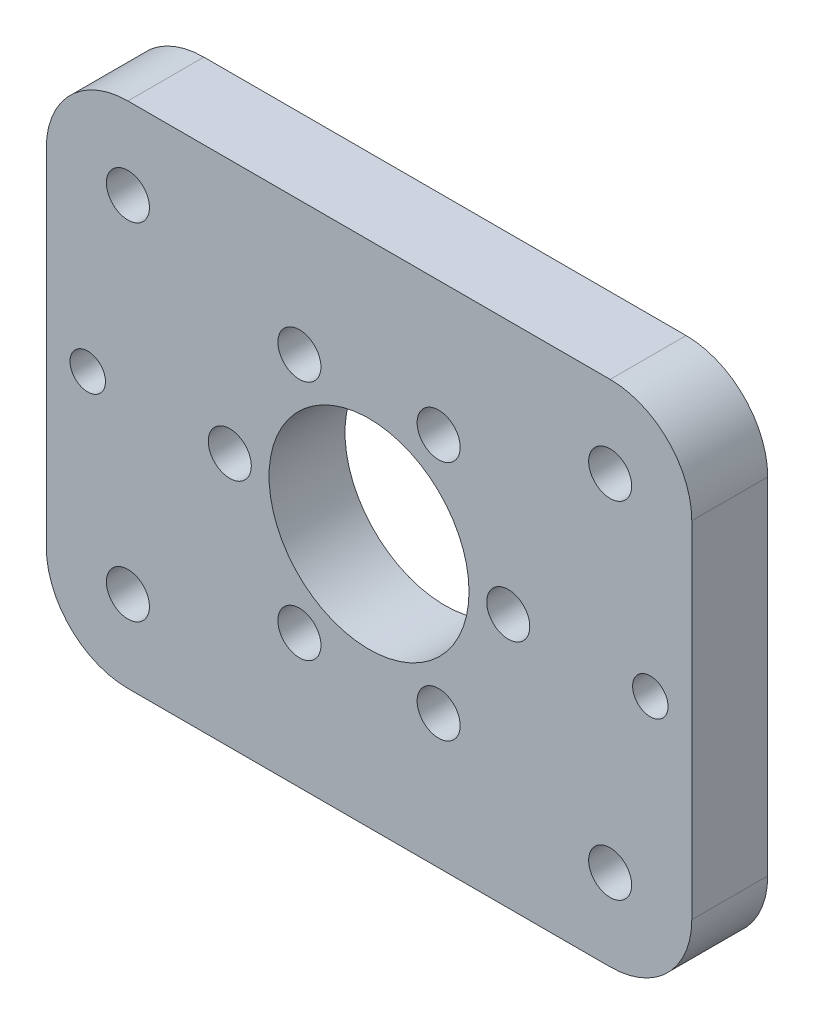
from build123d import *

# Parameters (mm, degrees)
SKETCH1_W           = 50.8
SKETCH1_H           = 40
SKETCH1_R           = 8
BOSS_EXTRUDE1_DEPTH = 6
FILLET1_R           = 6.35
SKETCH8_R           = 1.5
CUT_EXTRUDE1_DEPTH  = 33.880997552
SKETCH9_R           = 1.8
M3_THROUGH_DEPTH    = 33.880997552
MOVE_FACE2_BY       = 0.1
MOVE_FACE2_2_BY     = 0.1
MOVE_FACE2_3_BY     = 0.1
MOVE_FACE2_4_BY     = 0.1
MOVE_FACE2_5_BY     = 0.1
MOVE_FACE2_6_BY     = 0.1
MOVE_FACE2_7_BY     = 0.1
MOVE_FACE2_8_BY     = 0.1
MOVE_FACE2_9_BY     = 0.1
MOVE_FACE2_10_BY    = 0.1
MOVE_FACE2_11_BY    = 0.1
MOVE_FACE2_12_BY    = 0.1
MOVE_FACE2_13_BY    = 0.1
MOVE_FACE2_14_BY    = 0.1
MOVE_FACE2_15_BY    = 0.1
MOVE_FACE2_16_BY    = 0.1
MOVE_FACE2_17_BY    = 0.1
MOVE_FACE2_18_BY    = 0.1
MOVE_FACE2_19_BY    = 0.1
MOVE_FACE2_20_BY    = 0.1
MOVE_FACE2_21_BY    = 0.1


with BuildPart() as part:
    # Sketch1 → Boss-Extrude1 (new body)
    with BuildSketch(Plane.XY):
        Rectangle(SKETCH1_W, SKETCH1_H)
        Circle(SKETCH1_R, mode=Mode.SUBTRACT)
    extrude(amount=BOSS_EXTRUDE1_DEPTH)

    # Fillet1
    fillet1_edges = [part.edges().sort_by_distance(p)[0] for p in [
        (-25.4, 20, 3),
        (25.4, 20, 3),
        (25.4, -20, 3),
        (-25.4, -20, 3),
    ]]
    fillet(fillet1_edges, radius=FILLET1_R)

    # Sketch8 → Cut-Extrude1 (cut, through all)
    with BuildSketch(Plane.XY.offset(6)):
        with Locations((22.225, 0)):
            Circle(SKETCH8_R)
        with Locations((-22.225, 0)):
            Circle(SKETCH8_R)
    extrude(amount=-CUT_EXTRUDE1_DEPTH, mode=Mode.SUBTRACT)

    # Sketch9 → M3-through (cut, through all)
    with BuildSketch(Plane.XY.offset(6)):
        with Locations((-19.05, 13.65)):
            Circle(SKETCH9_R)
        with Locations(Location((-19.05, -13.65, 0), (0, 0, 180))):
            Circle(SKETCH9_R)
        with Locations((19.05, -13.65)):
            Circle(SKETCH9_R)
        with Locations(Location((19.05, 13.65, 0), (0, 0, 180))):
            Circle(SKETCH9_R)
        with Locations((11, 0)):
            Circle(SKETCH9_R)
        with Locations((5.5, -9.526279442)):
            Circle(SKETCH9_R)
        with Locations((-5.5, -9.526279442)):
            Circle(SKETCH9_R)
        with Locations((-11, 0)):
            Circle(SKETCH9_R)
        with Locations((-5.5, 9.526279442)):
            Circle(SKETCH9_R)
        with Locations((5.5, 9.526279442)):
            Circle(SKETCH9_R)
    extrude(amount=-M3_THROUGH_DEPTH, mode=Mode.SUBTRACT)

    # Move Face2: a face moved outward by 0.1
    extrude(part.faces().sort_by_distance((-25.4, 0, 3))[0], amount=MOVE_FACE2_BY, dir=(-1, 0, 0))

    # Move Face2 2: a curved face moved outward by 0.1
    add(Solid.thicken(part.faces().sort_by_distance((-23.540128061, 18.140128061, 3))[0], MOVE_FACE2_2_BY))

    # Move Face2 3: a face moved outward by 0.1
    extrude(part.faces().sort_by_distance((0, 20, 3))[0], amount=MOVE_FACE2_3_BY, dir=(0, 1, 0))

    # Move Face2 4: a curved face moved outward by 0.1
    add(Solid.thicken(part.faces().sort_by_distance((23.540128061, 18.140128061, 3))[0], MOVE_FACE2_4_BY))

    # Move Face2 5: a face moved outward by 0.1
    extrude(part.faces().sort_by_distance((25.4, 0, 3))[0], amount=MOVE_FACE2_5_BY, dir=(1, 0, 0))

    # Move Face2 6: a face moved outward by 0.1
    extrude(part.faces().sort_by_distance((0, -20, 3))[0], amount=MOVE_FACE2_6_BY, dir=(0, -1, 0))

    # Move Face2 7: a curved face moved outward by 0.1
    add(Solid.thicken(part.faces().sort_by_distance((-17.25, -13.65, 3))[0], MOVE_FACE2_7_BY))

    # Move Face2 8: a curved face moved outward by 0.1
    add(Solid.thicken(part.faces().sort_by_distance((-8, 0, 3))[0], MOVE_FACE2_8_BY))

    # Move Face2 9: a curved face moved outward by 0.1
    add(Solid.thicken(part.faces().sort_by_distance((20.725, 0, 3))[0], MOVE_FACE2_9_BY))

    # Move Face2 10: a curved face moved outward by 0.1
    add(Solid.thicken(part.faces().sort_by_distance((-23.725, 0, 3))[0], MOVE_FACE2_10_BY))

    # Move Face2 11: a curved face moved outward by 0.1
    add(Solid.thicken(part.faces().sort_by_distance((-20.85, 13.65, 3))[0], MOVE_FACE2_11_BY))

    # Move Face2 12: a curved face moved outward by 0.1
    add(Solid.thicken(part.faces().sort_by_distance((17.25, -13.65, 3))[0], MOVE_FACE2_12_BY))

    # Move Face2 13: a curved face moved outward by 0.1
    add(Solid.thicken(part.faces().sort_by_distance((20.85, 13.65, 3))[0], MOVE_FACE2_13_BY))

    # Move Face2 14: a curved face moved outward by 0.1
    add(Solid.thicken(part.faces().sort_by_distance((9.2, 0, 3))[0], MOVE_FACE2_14_BY))

    # Move Face2 15: a curved face moved outward by 0.1
    add(Solid.thicken(part.faces().sort_by_distance((3.7, -9.526279442, 3))[0], MOVE_FACE2_15_BY))

    # Move Face2 16: a curved face moved outward by 0.1
    add(Solid.thicken(part.faces().sort_by_distance((-7.3, -9.526279442, 3))[0], MOVE_FACE2_16_BY))

    # Move Face2 17: a curved face moved outward by 0.1
    add(Solid.thicken(part.faces().sort_by_distance((-12.8, 0, 3))[0], MOVE_FACE2_17_BY))

    # Move Face2 18: a curved face moved outward by 0.1
    add(Solid.thicken(part.faces().sort_by_distance((-7.3, 9.526279442, 3))[0], MOVE_FACE2_18_BY))

    # Move Face2 19: a curved face moved outward by 0.1
    add(Solid.thicken(part.faces().sort_by_distance((3.7, 9.526279442, 3))[0], MOVE_FACE2_19_BY))

    # Move Face2 20: a curved face moved outward by 0.1
    add(Solid.thicken(part.faces().sort_by_distance((-23.540128061, -18.140128061, 3))[0], MOVE_FACE2_20_BY))

    # Move Face2 21: a curved face moved outward by 0.1
    add(Solid.thicken(part.faces().sort_by_distance((23.540128061, -18.140128061, 3))[0], MOVE_FACE2_21_BY))


solid = part.part
